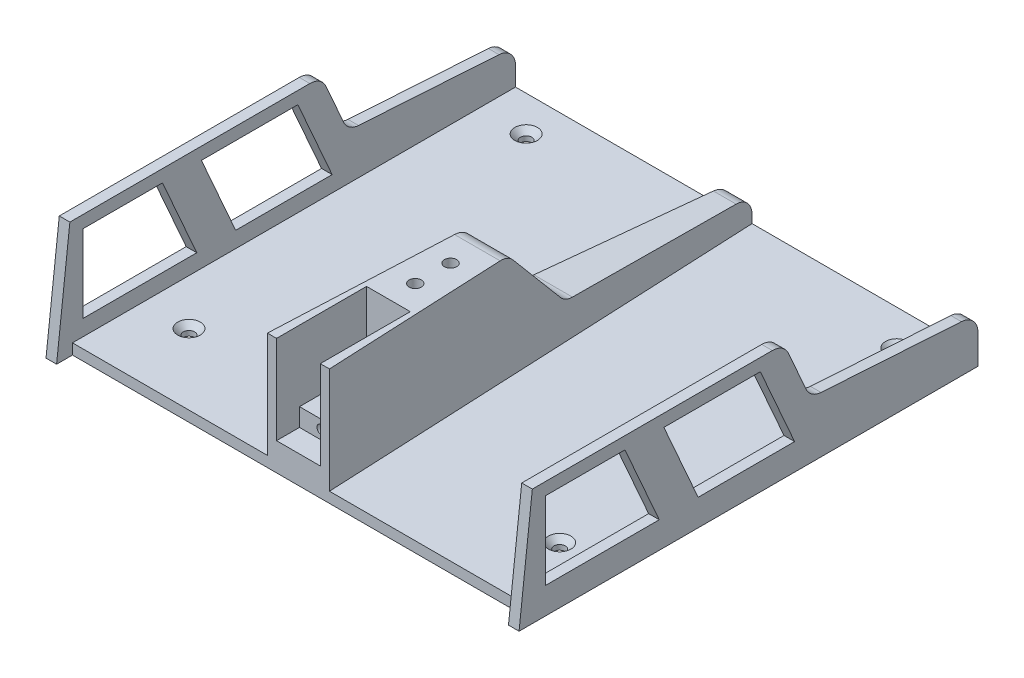
from build123d import *

# Parameters (mm, degrees)
SKETCH2_W                      = 3
SKETCH2_H                      = 130
BOSS_EXTRUDE1_DEPTH            = 3
SKETCH2_3_W                    = 3
SKETCH2_3_H                    = 130
BOSS_EXTRUDE2_DEPTH            = 30
CUT_EXTRUDE2_DEPTH             = 3
CUT_EXTRUDE3_DEPTH             = 190.092569923
CUT_EXTRUDE3_DEPTH_BACK        = 3
CUT_EXTRUDE4_REACH             = 151.812
CUT_EXTRUDE4_DIRECTION_2_REACH = 151.812
SKETCH9_W                      = 12.4
SKETCH9_H                      = 20
CUT_EXTRUDE5_DEPTH             = 30
CUT_EXTRUDE6_DEPTH             = 11
CUT_EXTRUDE7_DEPTH             = 4.5
CUT_EXTRUDE8_DEPTH             = 17
SKETCH3_W                      = 22.5
SKETCH3_H                      = 22
CUT_EXTRUDE1_DEPTH             = 3
SKETCH10_W                     = 22.5
SKETCH10_H                     = 22
CUT_EXTRUDE9_DEPTH             = 3
CUT_EXTRUDE10_DEPTH            = 190.092569923
FILLET1_R                      = 5
HOLE1_D                        = 3.5
HOLE1_DEPTH                    = 20
HOLE2_D                        = 3.2
HOLE2_DEPTH                    = 4.737087713
HOLE2_CSINK_D                  = 6.4
HOLE2_CSINK_ANGLE              = 90


with BuildPart() as part:
    # Sketch2 → Boss-Extrude1 (new body)
    with BuildSketch(Plane(origin=(0, 0, 0), x_dir=(1, 0, 0), z_dir=(0, 1, 0))):
        Polygon((-3, 130), (-64, 130), (-64, 0), (-9, 0), align=None)
        with Locations((-65.5, 65)):
            Rectangle(SKETCH2_W, SKETCH2_H)
        Polygon((0, 130), (-3, 130), (-9, 0), (0, 0), align=None)
        Polygon((3, 130), (0, 130), (0, 0), (9, 0), align=None)
        Polygon((64, 130), (3, 130), (9, 0), (64, 0), align=None)
        with Locations((65.5, 65)):
            Rectangle(SKETCH2_W, SKETCH2_H)
    extrude(amount=-BOSS_EXTRUDE1_DEPTH)

    # Sketch2<3> → Boss-Extrude2 (add)
    with BuildSketch(Plane(origin=(0, 0, 0), x_dir=(1, 0, 0), z_dir=(0, 1, 0))):
        Polygon((0, 130), (-3, 130), (-9, 0), (0, 0), align=None)
        Polygon((3, 130), (0, 130), (0, 0), (9, 0), align=None)
        with Locations((-65.5, 65)):
            Rectangle(SKETCH2_3_W, SKETCH2_3_H)
        with Locations((65.5, 65)):
            Rectangle(SKETCH2_3_W, SKETCH2_3_H)
    extrude(amount=BOSS_EXTRUDE2_DEPTH)

    # Sketch5 → Cut-Extrude2 (cut)
    with BuildSketch(Plane.ZY.offset(67)):
        Polygon((-130, 30), (-130, 10), (-82.5, 13), (-75, 30), align=None)
    extrude(amount=-CUT_EXTRUDE2_DEPTH, mode=Mode.SUBTRACT)

    # Sketch6 → Cut-Extrude3 (cut, two sides: drawn at the far end of the back side and taken through both)
    with BuildSketch(Plane(origin=(67, 0, 0), x_dir=(0, 0, -1), z_dir=(1, 0, 0)).offset(-CUT_EXTRUDE3_DEPTH_BACK)):
        Polygon((75, 30), (82.5, 13), (130, 10), (130, 30), align=None)
    extrude(amount=CUT_EXTRUDE3_DEPTH + CUT_EXTRUDE3_DEPTH_BACK, mode=Mode.SUBTRACT)

    # Cut-Extrude4: up to this plane
    cut_extrude4_end = Plane(origin=(-8.980869154, 30, -0.414501653), z_dir=(0.9989366098486855, 0, 0.04610476660840086))
    # Sketch7 → Cut-Extrude4 (cut, up to the surface)
    with BuildSketch(Plane(origin=(1.5, 0, -0.187149168), x_dir=(0, 0, -1), z_dir=(1, 0, 0)), mode=Mode.PRIVATE) as cut_extrude4_sk1:
        Polygon((129.812850832, 7), (74.312850832, 10), (57.312850832, 30), (129.812850832, 30), align=None)
    cut_extrude4_tool1 = split(extrude(cut_extrude4_sk1.sketch, amount=-CUT_EXTRUDE4_REACH, mode=Mode.PRIVATE), bisect_by=cut_extrude4_end, keep=Keep.BOTH, mode=Mode.PRIVATE)
    add(cut_extrude4_tool1.solids().sort_by_distance((1.5, 19.743933, -98.647747))[0], mode=Mode.SUBTRACT)

    # Cut-Extrude4 direction 2: up to this plane
    cut_extrude4_direction_2_end = Plane(origin=(8.980869154, 30, -0.414501653), z_dir=(0.9989366098486855, 0, -0.04610476660840086))
    # Sketch7 → Cut-Extrude4 direction 2 (cut, up to the surface)
    with BuildSketch(Plane(origin=(1.5, 0, -0.187149168), x_dir=(0, 0, -1), z_dir=(1, 0, 0)), mode=Mode.PRIVATE) as cut_extrude4_direction_2_sk1:
        Polygon((129.812850832, 7), (74.312850832, 10), (57.312850832, 30), (129.812850832, 30), align=None)
    cut_extrude4_direction_2_tool1 = split(extrude(cut_extrude4_direction_2_sk1.sketch, amount=CUT_EXTRUDE4_DIRECTION_2_REACH, mode=Mode.PRIVATE), bisect_by=cut_extrude4_direction_2_end, keep=Keep.BOTH, mode=Mode.PRIVATE)
    add(cut_extrude4_direction_2_tool1.solids().sort_by_distance((1.5, 19.743933, -98.647747))[0], mode=Mode.SUBTRACT)

    # Sketch9 → Cut-Extrude5 (cut)
    with BuildSketch(Plane.XY):
        with Locations((0, 20)):
            Rectangle(SKETCH9_W, SKETCH9_H)
    extrude(amount=-CUT_EXTRUDE5_DEPTH, mode=Mode.SUBTRACT)

    # Sketch9<3> → Cut-Extrude6 (cut)
    with BuildSketch(Plane.XY):
        with BuildLine():
            Line((0, 10), (-6.2, 10))
            Line((-6.2, 10), (-6.2, 4.9))
            Line((-6.2, 4.9), (0, 4.9))
            Line((0, 4.9), (0, 6.2))
            ThreePointArc((0, 6.2), (-1.25, 7.45), (0, 8.7))
            Line((0, 8.7), (0, 10))
        make_face()
        with BuildLine():
            Line((6.2, 4.9), (6.2, 10))
            Line((6.2, 10), (0, 10))
            Line((0, 10), (0, 8.7))
            ThreePointArc((0, 8.7), (0.883883476, 8.333883476), (1.25, 7.45))
            ThreePointArc((1.25, 7.45), (0.883883476, 6.566116524), (0, 6.2))
            Line((0, 6.2), (0, 4.9))
            Line((0, 4.9), (6.2, 4.9))
        make_face()
    extrude(amount=-CUT_EXTRUDE6_DEPTH, mode=Mode.SUBTRACT)

    # Sketch9<4> → Cut-Extrude7 (cut)
    with BuildSketch(Plane.XY):
        Polygon((-6.2, 10), (-6.2, 30), (-9, 30), (-9, 0), (9, 0), (9, 30), (6.2, 30), (6.2, 10), (6.2, 4.9), (-6.2, 4.9), align=None)
        Polygon((9, 0), (-9, 0), (-64, 0), (-64, -3), (64, -3), (64, 0), align=None)
    extrude(amount=-CUT_EXTRUDE7_DEPTH, mode=Mode.SUBTRACT)

    # Sketch9<5> → Cut-Extrude8 (cut)
    with BuildSketch(Plane.XY):
        with BuildLine():
            ThreePointArc((1.25, 7.45), (0.883883476, 8.333883476), (0, 8.7))
            Line((0, 8.7), (0, 6.2))
            ThreePointArc((0, 6.2), (0.883883476, 6.566116524), (1.25, 7.45))
        make_face()
        with BuildLine():
            Line((0, 6.2), (0, 8.7))
            ThreePointArc((0, 8.7), (-1.25, 7.45), (0, 6.2))
        make_face()
    extrude(amount=-CUT_EXTRUDE8_DEPTH, mode=Mode.SUBTRACT)

    # Sketch3 → Cut-Extrude1 (cut)
    with BuildSketch(Plane.ZY.offset(67)):
        Polygon((-50.727683193, 4.5), (-78.052542275, 4.5), (-68.346659922, 26.5), (-41.02180084, 26.5), align=None)
        with Locations((-18.75, 15.5)):
            Rectangle(SKETCH3_W, SKETCH3_H)
        Polygon((-30, 4.5), (-30, 26.5), (-39.705882353, 4.5), align=None)
    extrude(amount=-CUT_EXTRUDE1_DEPTH, mode=Mode.SUBTRACT)

    # Sketch10 → Cut-Extrude9 (cut)
    with BuildSketch(Plane(origin=(67, 0, 0), x_dir=(0, 0, -1), z_dir=(1, 0, 0))):
        with Locations((18.75, 15.5)):
            Rectangle(SKETCH10_W, SKETCH10_H)
        Polygon((30, 4.5), (30, 26.5), (39.705882353, 4.5), align=None)
        Polygon((50.727683193, 4.5), (78.052542275, 4.5), (68.346659922, 26.5), (41.02180084, 26.5), align=None)
    extrude(amount=-CUT_EXTRUDE9_DEPTH, mode=Mode.SUBTRACT)

    # Sketch11 → Cut-Extrude10 (cut, through all)
    with BuildSketch(Plane.ZY.offset(67)):
        Polygon((0, -3), (-3.759875074, 30), (0, 30), align=None)
    extrude(amount=-CUT_EXTRUDE10_DEPTH, mode=Mode.SUBTRACT)

    # Fillet1
    fillet1_edges = [part.edges().sort_by_distance(p)[0] for p in [
        (-65.5, 30, -75),
        (-65.5, 10, -130),
        (-65.5, 13, -82.5),
        (65.5, 30, -75),
        (65.5, 13, -82.5),
        (65.5, 10, -130),
        (0, 10, -74.5),
        (0, 30, -57.5),
        (0, 7, -130),
    ]]
    fillet(fillet1_edges, radius=FILLET1_R)

    # Hole1
    with Locations(Plane(origin=(0, 30, -47.593898813), x_dir=(0, 0, 1), z_dir=(0, 1, 0))):
        with Locations((0, 0), (10, 0)):
            Hole(HOLE1_D / 2, depth=HOLE1_DEPTH)

    # Hole2
    with Locations(Plane(origin=(-51, 0, -120), x_dir=(0, 0, 1), z_dir=(0, 1, 0))):
        with Locations((0, 0), (0, 105), (95.5, 105), (95.5, 0)):
            CounterSinkHole(HOLE2_D / 2, HOLE2_CSINK_D / 2, depth=HOLE2_DEPTH, counter_sink_angle=HOLE2_CSINK_ANGLE)


solid = part.part
